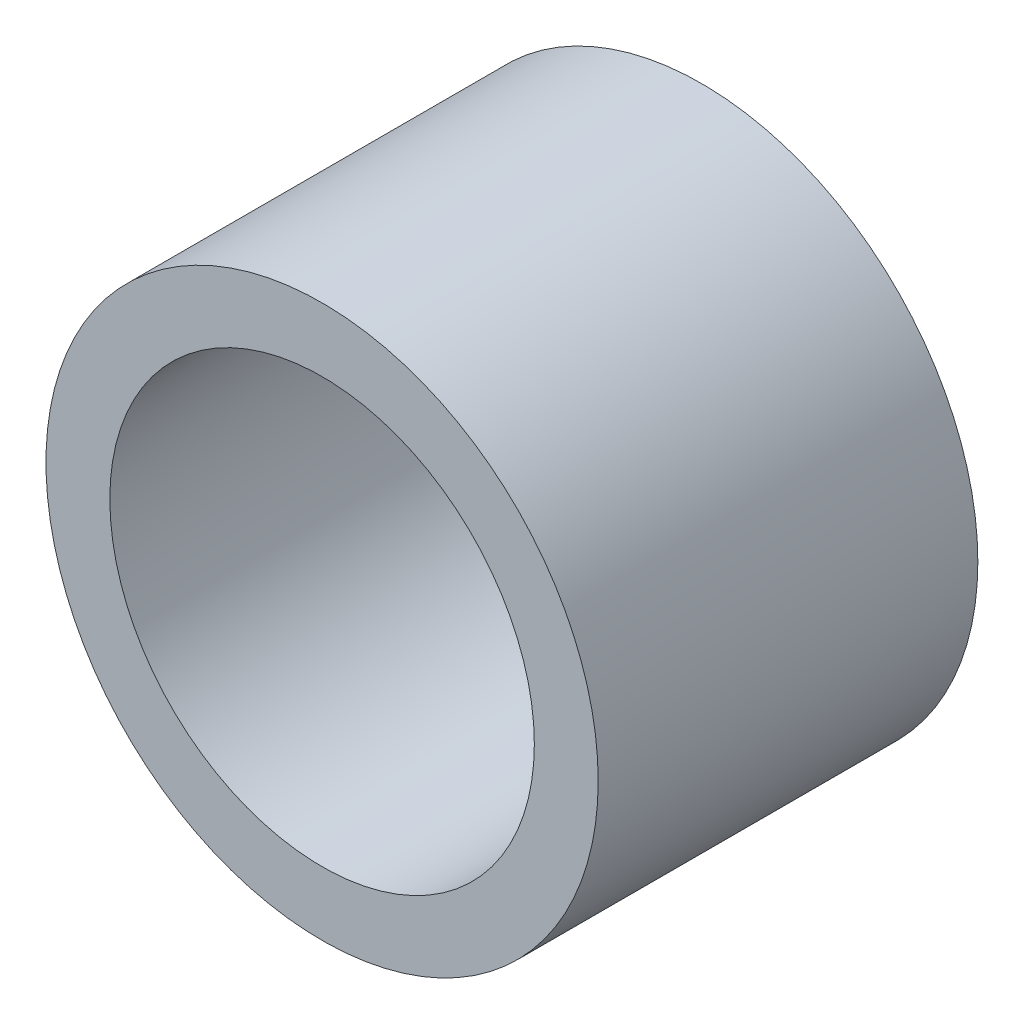
from build123d import *

# Parameters (mm, degrees)
S01_HARDENED_SIXTEEN_MILLIMETRE_RUNNIN_R       = 8
S01_HARDENED_SIXTEEN_MILLIMETRE_RUNNIN_R_2     = 6.15
F_01_HARDENED_SIXTEEN_MILLIMETRE_RUNNING_DEPTH = 11


with BuildPart() as part:
    # S01 - Hardened sixteen millimetre running surface → 01 - Hardened sixteen millimetre running surface (new body)
    with BuildSketch(Plane.XY):
        Circle(S01_HARDENED_SIXTEEN_MILLIMETRE_RUNNIN_R)
        Circle(S01_HARDENED_SIXTEEN_MILLIMETRE_RUNNIN_R_2, mode=Mode.SUBTRACT)
    extrude(amount=F_01_HARDENED_SIXTEEN_MILLIMETRE_RUNNING_DEPTH)


solid = part.part
